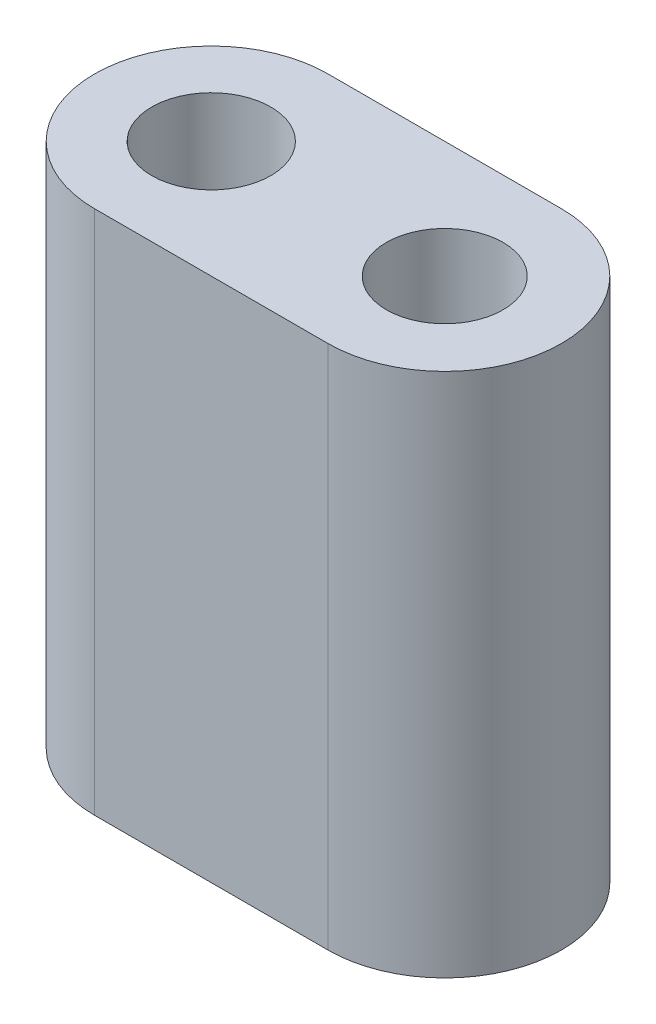
from build123d import *

# Parameters (mm, degrees)
SKETCH1_R           = 3.2385
SKETCH1_R_2         = 3.175
BOSS_EXTRUDE1_DEPTH = 28.575
SKETCH2_R           = 3.175
SKETCH2_R_2         = 2.38125
BOSS_EXTRUDE2_DEPTH = 3.175


with BuildPart() as part:
    # Sketch1 → Boss-Extrude1 (new body)
    with BuildSketch(Plane(origin=(0, 0, 0), x_dir=(1, 0, 0), z_dir=(0, 1, 0))):
        with BuildLine():
            Line((0, 6.35), (12.7, 6.35))
            ThreePointArc((12.7, 6.35), (19.05, 0), (12.7, -6.35))
            Line((12.7, -6.35), (0, -6.35))
            ThreePointArc((0, -6.35), (-6.35, 0), (0, 6.35))
        make_face()
        with Locations(Location((0, 0, 0), (0, 0, 270))):
            Circle(SKETCH1_R, mode=Mode.SUBTRACT)
        with Locations(Location((12.7, 0, 0), (0, 0, 270))):
            Circle(SKETCH1_R_2, mode=Mode.SUBTRACT)
    extrude(amount=BOSS_EXTRUDE1_DEPTH)

    # Sketch2 → Boss-Extrude2 (add)
    with BuildSketch(Plane.XZ):
        with Locations(Location((12.7, 0, 0), (0, 0, 270))):
            Circle(SKETCH2_R)
        with Locations(Location((12.7, 0, 0), (0, 0, 270))):
            Circle(SKETCH2_R_2, mode=Mode.SUBTRACT)
    extrude(amount=-BOSS_EXTRUDE2_DEPTH)


solid = part.part
